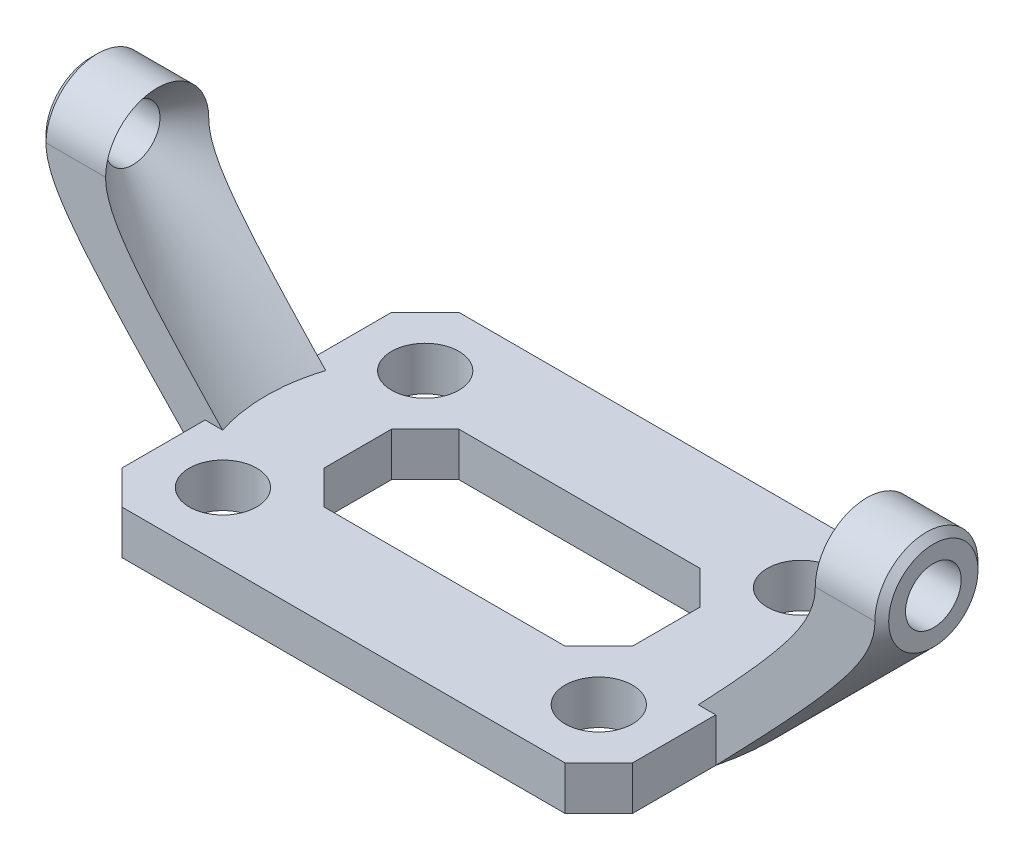
from build123d import *

# Parameters (mm, degrees)
CUT_EXTRUDE1_DEPTH      = 38.5
CUT_EXTRUDE1_DEPTH_BACK = 38.5
SKETCH2_OUTSIDE_W       = 39.248
SKETCH2_OUTSIDE_H       = 39.248
SKETCH11_W              = 30.3
SKETCH11_H              = 2.599351838
BOSS_EXTRUDE2_DEPTH     = 10
CUT_EXTRUDE6_DEPTH      = 45.205596297
CUT_EXTRUDE6_DEPTH_BACK = 45.205596297
SKETCH13_W              = 18.3
SKETCH13_H              = 8
CUT_EXTRUDE7_DEPTH      = 30.719750749
SKETCH14_R              = 2
CUT_EXTRUDE8_DEPTH      = 30.719750749
CHAMFER1_SIZE           = 2


with BuildPart() as part:
    # Sketch1 → Revolve1 (revolve)
    with BuildSketch(Plane.XY, mode=Mode.PRIVATE) as revolve1_sk:
        Polygon((15.15, 0), (25, 9.85), (25, 10.85), (22.5, 10.85), (22.5, 10.885533906), (14.114466094, 2.5), (-14.114466094, 2.5), (-22.5, 10.885533906), (-22.5, 10.85), (-25, 10.85), (-25, 9.85), (-15.15, 0), align=None)
    revolve(revolve1_sk.sketch.rotate(Axis((-0.079113924, 12.5, 0), (1, 0, 0)), 270), axis=Axis((-0.079113924, 12.5, 0), (1, 0, 0)))

    # Sketch2 outside → Cut-Extrude1 (cut, two sides: drawn at the far end of the back side and taken through both)
    with BuildSketch(Plane(origin=(0, 0, 0), x_dir=(0, 0, -1), z_dir=(1, 0, 0)).offset(-CUT_EXTRUDE1_DEPTH_BACK)):
        with Locations((0, 12.5)):
            Rectangle(SKETCH2_OUTSIDE_W, SKETCH2_OUTSIDE_H)
        with BuildLine():
            Line((-3.059956427, 12.5), (-3.059956427, 0.380319036))
            ThreePointArc((-3.059956427, 0.380319036), (0, 0), (3.059956427, 0.380319036))
            Line((3.059956427, 0.380319036), (3.059956427, 12.5))
            ThreePointArc((3.059956427, 12.5), (0, 15.559956427), (-3.059956427, 12.5))
        make_face(mode=Mode.SUBTRACT)
    extrude(amount=CUT_EXTRUDE1_DEPTH + CUT_EXTRUDE1_DEPTH_BACK, mode=Mode.SUBTRACT)

    # Sketch11 → Boss-Extrude2 (add, symmetric)
    with BuildSketch(Plane.XY):
        with Locations((0, 1.679994955)):
            Rectangle(SKETCH11_W, SKETCH11_H)
    extrude(amount=BOSS_EXTRUDE2_DEPTH, both=True)

    # Sketch12 → Cut-Extrude6 (cut, two sides: drawn at the far end of the back side and taken through both)
    with BuildSketch(Plane.ZY.offset(15.15).offset(-CUT_EXTRUDE6_DEPTH_BACK)):
        with BuildLine():
            Line((-3.059956427, 0.380319036), (3.059956427, 0.380319036))
            ThreePointArc((3.059956427, 0.380319036), (0, 0), (-3.059956427, 0.380319036))
        make_face()
    extrude(amount=CUT_EXTRUDE6_DEPTH + CUT_EXTRUDE6_DEPTH_BACK, mode=Mode.SUBTRACT)

    # Sketch13 → Cut-Extrude7 (cut, through all)
    with BuildSketch(Plane(origin=(0, 2.979670874, 0), x_dir=(1, 0, 0), z_dir=(0, 1, 0))):
        Rectangle(SKETCH13_W, SKETCH13_H)
    extrude(amount=-CUT_EXTRUDE7_DEPTH, mode=Mode.SUBTRACT)

    # Sketch14 → Cut-Extrude8 (cut, through all)
    with BuildSketch(Plane(origin=(0, 2.979670874, 0), x_dir=(1, 0, 0), z_dir=(0, 1, 0))):
        with Locations(Location((11.15, -6, 0), (0, 0, 270))):
            Circle(SKETCH14_R)
        with Locations(Location((-11.15, -6, 0), (0, 0, 90))):
            Circle(SKETCH14_R)
        with Locations(Location((-11.15, 6, 0), (0, 0, 270))):
            Circle(SKETCH14_R)
        with Locations(Location((11.15, 6, 0), (0, 0, 90))):
            Circle(SKETCH14_R)
    extrude(amount=-CUT_EXTRUDE8_DEPTH, mode=Mode.SUBTRACT)

    # Chamfer1
    chamfer1_edges = [part.edges().sort_by_distance(p)[0] for p in [
        (-9.15, 1.679994955, -4),
        (9.15, 1.679994955, -4),
        (9.15, 1.679994955, 4),
        (-9.15, 1.679994955, 4),
        (15.15, 1.679994955, -10),
        (-15.15, 1.679994955, -10),
        (15.15, 1.679994955, 10),
        (-15.15, 1.679994955, 10),
    ]]
    chamfer(chamfer1_edges, length=CHAMFER1_SIZE)


solid = part.part
